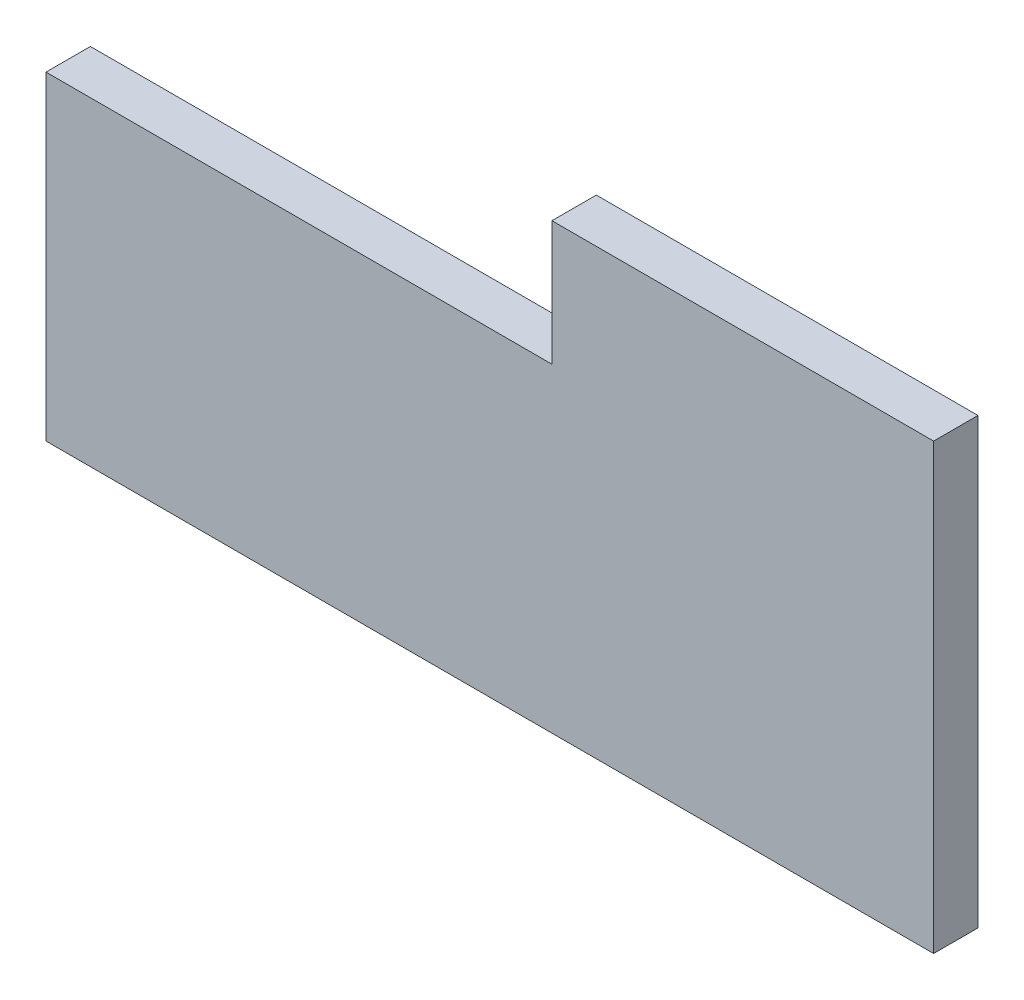
from build123d import *

# Parameters (mm, degrees)
BOSS_EXTRUDE1_DEPTH = 6.35


with BuildPart() as part:
    # Sketch1 → Boss-Extrude1 (new, symmetric)
    with BuildSketch(Plane.XY):
        Polygon((-127, 27.94), (17.78, 27.94), (17.78, 63.5), (127, 63.5), (127, -63.5), (-127, -63.5), align=None)
    extrude(amount=BOSS_EXTRUDE1_DEPTH, both=True)


solid = part.part
